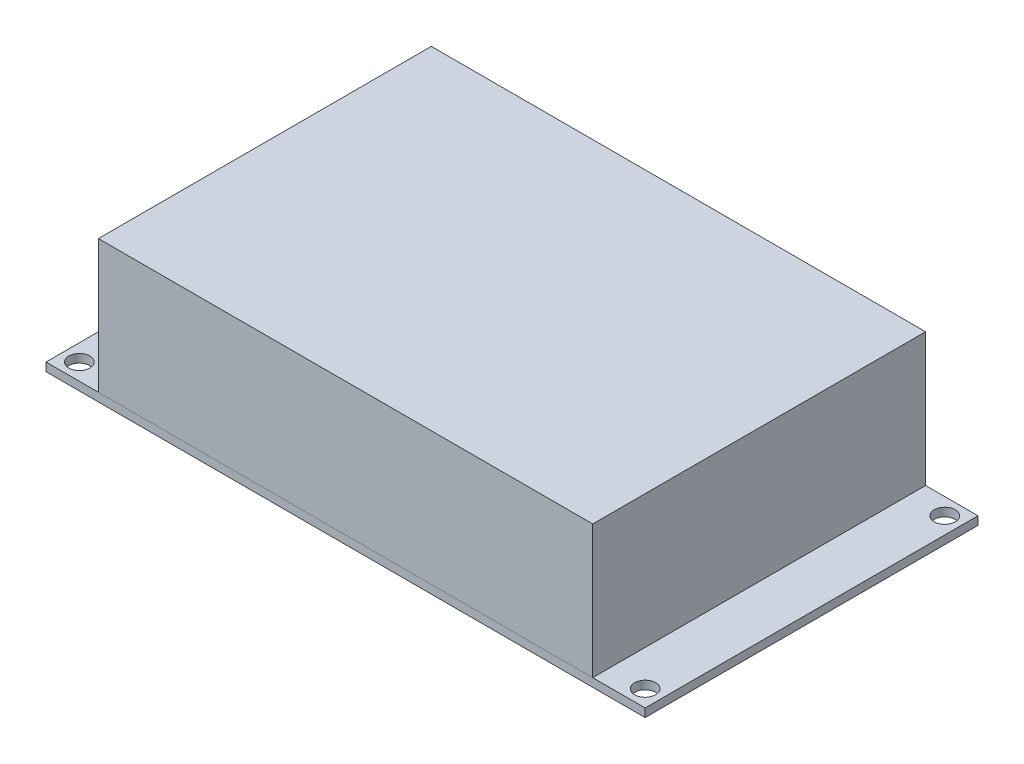
from build123d import *

# Parameters (mm, degrees)
ESQUISSE1_W             = 114.3
ESQUISSE1_H             = 63.5
EXTRUSION1_DEPTH        = 1.6
ESQUISSE2_R             = 2
ENL_V_MAT_EXTRU_1_DEPTH = 1.6
ESQUISSE4_W             = 94.3
ESQUISSE4_H             = 63.5
EXTRUSION4_DEPTH        = 25.4


with BuildPart() as part:
    # Esquisse1 → Extrusion1 (new body)
    with BuildSketch(Plane(origin=(0, 0, 0), x_dir=(1, 0, 0), z_dir=(0, 1, 0))):
        with Locations((57.15, 31.75)):
            Rectangle(ESQUISSE1_W, ESQUISSE1_H)
    extrude(amount=EXTRUSION1_DEPTH)

    # Esquisse2 → Enlèv. mat.-Extru.1 (cut)
    with BuildSketch(Plane(origin=(0, 1.6, 0), x_dir=(-1, 0, 0), z_dir=(0, 1, 0))):
        with Locations(Location((-3.175, -60.325, 0), (0, 0, 90))):
            Circle(ESQUISSE2_R)
        with Locations(Location((-3.175, -3.175, 0), (0, 0, 90))):
            Circle(ESQUISSE2_R)
        with Locations(Location((-111.125, -60.325, 0), (0, 0, 90))):
            Circle(ESQUISSE2_R)
        with Locations(Location((-111.125, -3.175, 0), (0, 0, 90))):
            Circle(ESQUISSE2_R)
    extrude(amount=-ENL_V_MAT_EXTRU_1_DEPTH, mode=Mode.SUBTRACT)


with BuildPart() as body_2:
    # Esquisse4 → Extrusion4 (new body)
    with BuildSketch(Plane(origin=(0, 1.6, 0), x_dir=(-1, 0, 0), z_dir=(0, 1, 0))):
        with Locations((-57.15, -31.75)):
            Rectangle(ESQUISSE4_W, ESQUISSE4_H)
    extrude(amount=EXTRUSION4_DEPTH)


solid = Compound([part.part, body_2.part])
